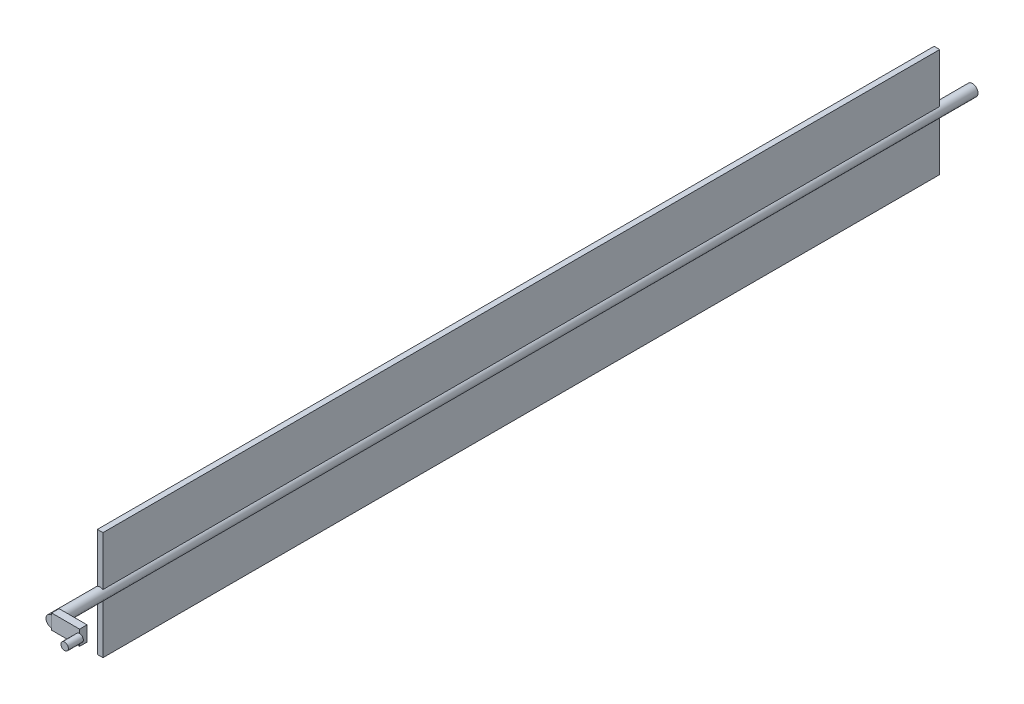
from build123d import *

# Parameters (mm, degrees)
SKETCH1_W       = 4
SKETCH1_H       = 8
CRANK_DEPTH     = 15
BLADE_START     = -1.5
SKETCH2_W       = 448
SKETCH2_H       = 58
BLADE_DEPTH     = 3
PIVOT_PIN_START = 2
SKETCH3_R       = 3
PIVOT_PIN_DEPTH = 493
CRANK_PIN_START = 495
SKETCH4_R       = 2
CRANK_PIN_DEPTH = 8


with BuildPart() as part:
    # Sketch1 → crank (new body)
    with BuildSketch(Plane(origin=(0, 0, 0), x_dir=(0, 0, -1), z_dir=(1, 0, 0))):
        with Locations((-493, 0)):
            Rectangle(SKETCH1_W, SKETCH1_H)
    extrude(amount=CRANK_DEPTH)


with BuildPart() as body_2:
    # Sketch2 → blade (new body)
    with BuildSketch(Plane(origin=(0, 0, 0), x_dir=(0, 0, -1), z_dir=(1, 0, 0)).offset(BLADE_START)):
        with Locations((-245, 0)):
            Rectangle(SKETCH2_W, SKETCH2_H)
    extrude(amount=BLADE_DEPTH)


with BuildPart() as body_3:
    # Sketch3 → pivot_pin (new body)
    with BuildSketch(Plane.XY.offset(PIVOT_PIN_START)):
        Circle(SKETCH3_R)
    extrude(amount=PIVOT_PIN_DEPTH)


with BuildPart() as body_4:
    # Sketch4 → crank_pin (new body)
    with BuildSketch(Plane.XY.offset(CRANK_PIN_START)):
        with Locations((15, 0)):
            Circle(SKETCH4_R)
    extrude(amount=CRANK_PIN_DEPTH)


solid = Compound([part.part, body_2.part, body_3.part, body_4.part])
